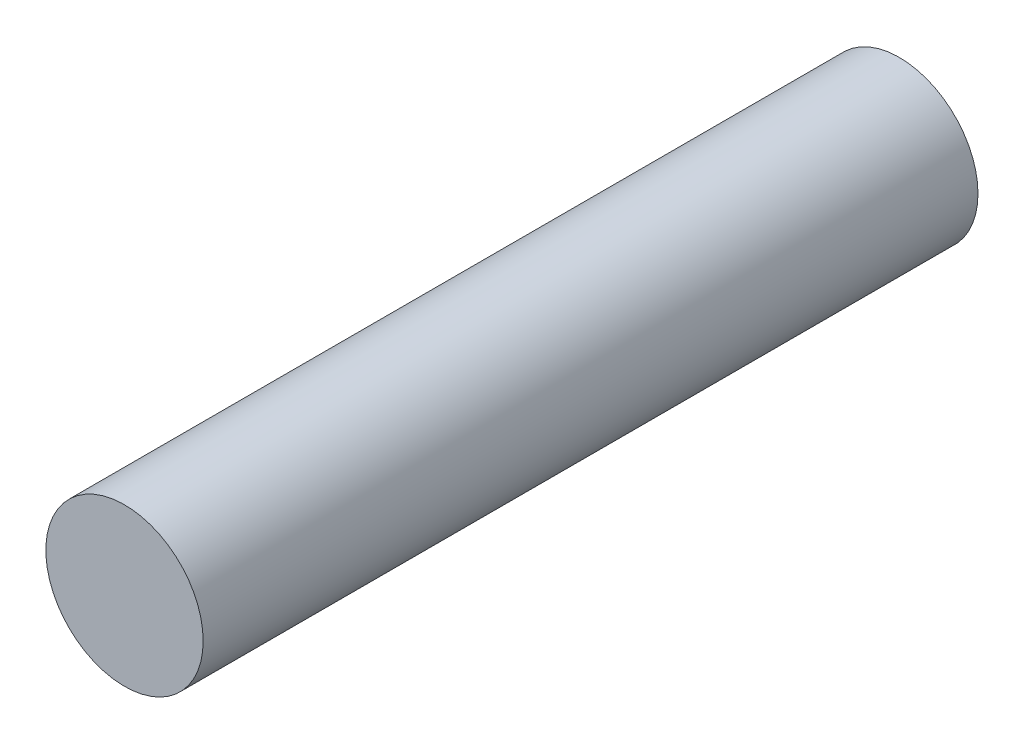
from build123d import *

# Parameters (mm, degrees)
SKETCH_1_R      = 1
EXTRUDE_2_DEPTH = 9.85


with BuildPart() as part:
    # 草图1 → 凸台-拉伸2 (new body)
    with BuildSketch(Plane.XY):
        Circle(SKETCH_1_R)
    extrude(amount=EXTRUDE_2_DEPTH)


solid = part.part
